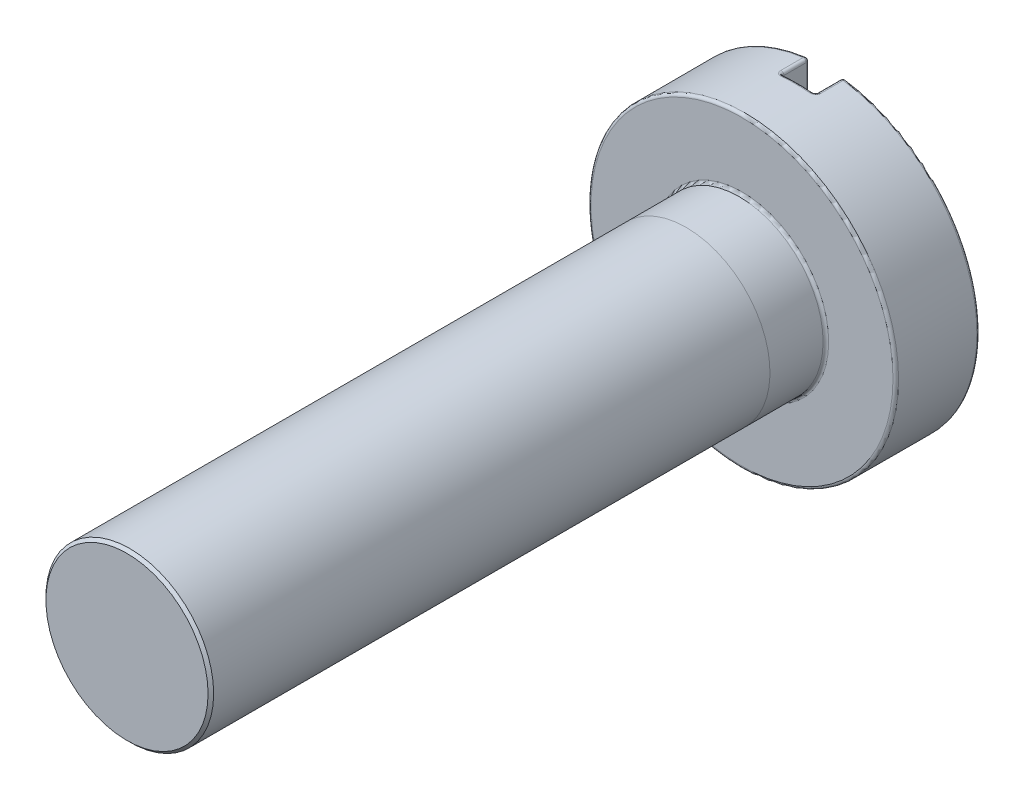
from build123d import *

# Parameters (mm, degrees)
SKETCH1_R           = 1.5
BOSS_EXTRUDE1_DEPTH = 11
SKETCH2_R           = 2.75
BOSS_EXTRUDE2_DEPTH = 1.5
SKETCH3_W           = 0.6
SKETCH3_H           = 8.393754192
CUT_EXTRUDE1_DEPTH  = 0.5
FILLET1_R           = 0.05
FILLET2_R           = 0.05
CHAMFER1_SIZE       = 0.05


with BuildPart() as part:
    # Sketch1 → Boss-Extrude1 (new body)
    with BuildSketch(Plane.XY):
        Circle(SKETCH1_R)
    extrude(amount=BOSS_EXTRUDE1_DEPTH)

    # Sketch2 → Boss-Extrude2 (add)
    with BuildSketch(Plane.XY):
        Circle(SKETCH2_R)
    extrude(amount=-BOSS_EXTRUDE2_DEPTH)

    # Sketch3 → Cut-Extrude1 (cut)
    with BuildSketch(Plane(origin=(0, 0, -1.5), x_dir=(-1, 0, 0), z_dir=(0, 0, -1))):
        Rectangle(SKETCH3_W, SKETCH3_H)
    extrude(amount=-CUT_EXTRUDE1_DEPTH, mode=Mode.SUBTRACT)

    # Fillet1
    fillet1_edges = [part.edges().sort_by_distance(p)[0] for p in [
        (-2.75, 0, -1.5),
        (2.047864742, -1.835415484, -1.5),
        (0.3, 0, -1.5),
        (-0.3, 0, -1.5),
        (0, 2.75, -1),
        (0, -2.75, -1),
        (-0.3, -2.733587387, -1.25),
        (-0.3, 2.733587387, -1.25),
        (0.3, 2.733587387, -1.25),
        (0.3, -2.733587387, -1.25),
        (-0.3, 0, -1),
        (0.3, 0, -1),
        (-1.5, 0, 0),
    ]]
    fillet(fillet1_edges, radius=FILLET1_R)

    # Fillet2
    fillet2_edges = [part.edges().sort_by_distance(p)[0] for p in [
        (-2.75, 0, 0),
    ]]
    fillet(fillet2_edges, radius=FILLET2_R)

    # Chamfer1
    chamfer1_edges = [part.edges().sort_by_distance(p)[0] for p in [
        (-1.5, 0, 11),
    ]]
    chamfer(chamfer1_edges, length=CHAMFER1_SIZE)


solid = part.part
